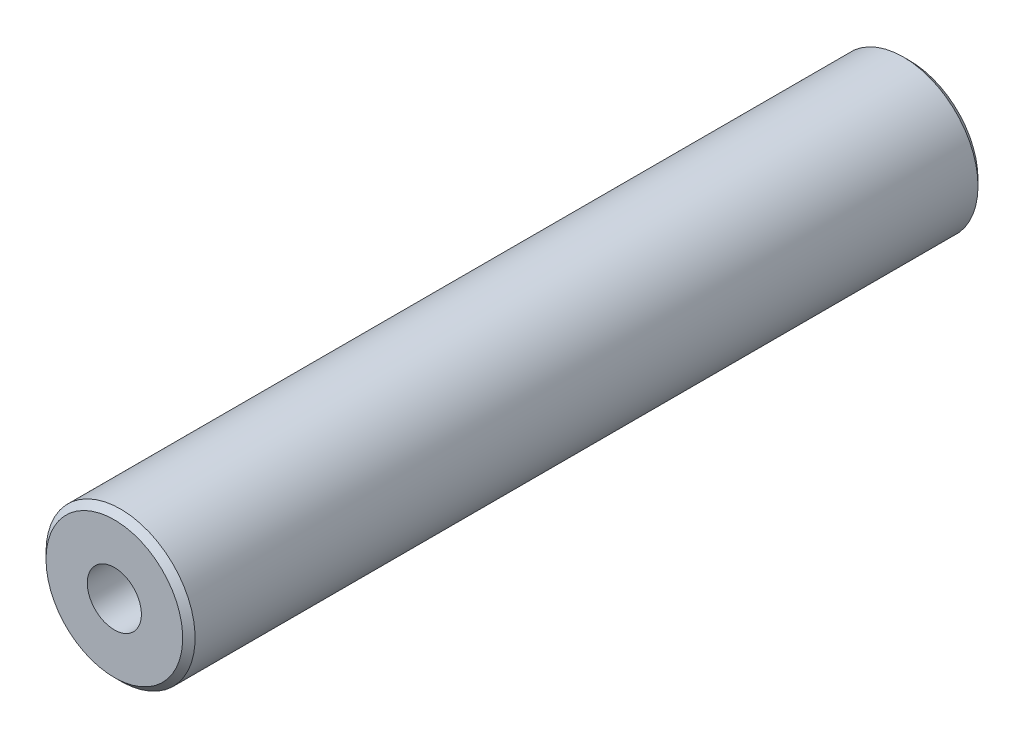
from build123d import *

# Parameters (mm, degrees)
SKETCH1_R                               = 4.7625
BOSS_EXTRUDE1_DEPTH                     = 25.4
TAP_DRILL_FOR_8_32_TAP1_D               = 3.4544
TAP_DRILL_FOR_8_32_TAP1_DEPTH           = 6.35
TAP_DRILL_FOR_8_32_TAP1_TIP             = 1.037806461
TAP_DRILL_FOR_8_32_TAP1_ON_FACE_2_D     = 3.4544
TAP_DRILL_FOR_8_32_TAP1_ON_FACE_2_DEPTH = 6.35
TAP_DRILL_FOR_8_32_TAP1_ON_FACE_2_TIP   = 1.037806461
CHAMFER1_SIZE                           = 0.396875


with BuildPart() as part:
    # Sketch1 → Boss-Extrude1 (new, symmetric)
    with BuildSketch(Plane.XY):
        Circle(SKETCH1_R)
    extrude(amount=BOSS_EXTRUDE1_DEPTH, both=True)

    # Tap Drill for #8-32 Tap1
    with Locations(Plane.XY.offset(25.4)):
        with Locations((0, 0)):
            Hole(TAP_DRILL_FOR_8_32_TAP1_D / 2, depth=TAP_DRILL_FOR_8_32_TAP1_DEPTH)
            with Locations((0, 0, -(TAP_DRILL_FOR_8_32_TAP1_DEPTH + TAP_DRILL_FOR_8_32_TAP1_TIP / 2))):  # 118° drill point
                Cone(0, TAP_DRILL_FOR_8_32_TAP1_D / 2, TAP_DRILL_FOR_8_32_TAP1_TIP, mode=Mode.SUBTRACT)

    # Tap Drill for #8-32 Tap1 on face 2
    with Locations(Plane(origin=(0, 0, -25.4), x_dir=(-1, 0, 0), z_dir=(0, 0, -1))):
        with Locations((0, 0)):
            Hole(TAP_DRILL_FOR_8_32_TAP1_ON_FACE_2_D / 2, depth=TAP_DRILL_FOR_8_32_TAP1_ON_FACE_2_DEPTH)
            with Locations((0, 0, -(TAP_DRILL_FOR_8_32_TAP1_ON_FACE_2_DEPTH + TAP_DRILL_FOR_8_32_TAP1_ON_FACE_2_TIP / 2))):  # 118° drill point
                Cone(0, TAP_DRILL_FOR_8_32_TAP1_ON_FACE_2_D / 2, TAP_DRILL_FOR_8_32_TAP1_ON_FACE_2_TIP, mode=Mode.SUBTRACT)

    # Chamfer1
    chamfer1_edges = [part.edges().sort_by_distance(p)[0] for p in [
        (-4.7625, 0, -25.4),
        (-4.7625, 0, 25.4),
    ]]
    chamfer(chamfer1_edges, length=CHAMFER1_SIZE)


solid = part.part
